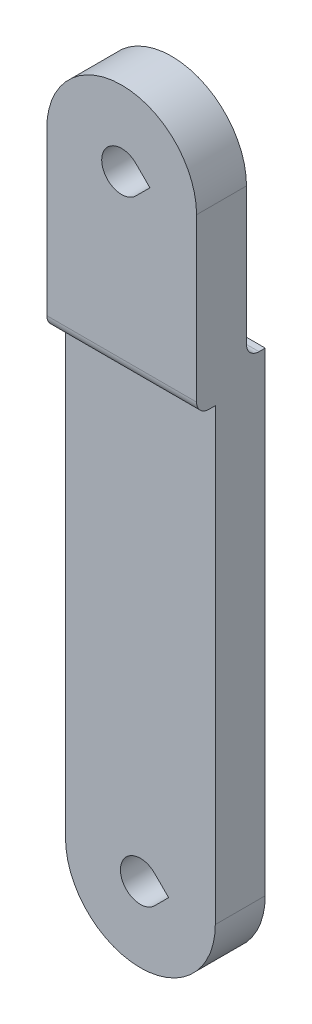
from build123d import *

# Parameters (mm, degrees)
EXTRUDE_1_DEPTH     = 11
SKETCH_2_W          = 14
SKETCH_2_H          = 18
SKETCH_2_W_2        = 11
SKETCH_2_H_2        = 41
SKETCH_2_W_3        = 1.5
SKETCH_2_H_3        = 42
CUT_EXTRUDE_1_DEPTH = 28
FILLET_1_R          = 1
SKETCH_3_W          = 132.309001911
SKETCH_3_H          = 95.019202257
CUT_EXTRUDE_2_DEPTH = 76


with BuildPart() as part:
    # 草图1 → 凸台-拉伸1 (new, symmetric)
    with BuildSketch(Plane.XY):
        with BuildLine():
            Line((6, 50), (6, 0))
            ThreePointArc((6, 0), (0, -6), (-6, 0))
            Line((-6, 0), (-6, 50))
            ThreePointArc((-6, 50), (0, 56), (6, 50))
        make_face()
        with BuildLine():
            Line((2.2627417, 50), (1.13137085, 51.13137085))
            ThreePointArc((1.13137085, 51.13137085), (-1.6, 50), (1.13137085, 48.86862915))
            Line((1.13137085, 48.86862915), (2.2627417, 50))
        make_face(mode=Mode.SUBTRACT)
        with BuildLine():
            Line((2.2627417, 0), (1.13137085, 1.13137085))
            ThreePointArc((1.13137085, 1.13137085), (-1.6, 0), (1.13137085, -1.13137085))
            Line((1.13137085, -1.13137085), (2.2627417, 0))
        make_face(mode=Mode.SUBTRACT)
    extrude(amount=EXTRUDE_1_DEPTH, both=True)

    # 草图2 → 切除-拉伸1 (cut)
    with BuildSketch(Plane(origin=(6, 0, 0), x_dir=(0, 0, -1), z_dir=(1, 0, 0))):
        with Locations((0, 47)):
            Rectangle(SKETCH_2_W, SKETCH_2_H)
        with Locations((0, 14.5)):
            Rectangle(SKETCH_2_W_2, SKETCH_2_H_2)
        with Locations((-10.25, 15)):
            Rectangle(SKETCH_2_W_3, SKETCH_2_H_3)
        with Locations((10.25, 15)):
            Rectangle(SKETCH_2_W_3, SKETCH_2_H_3)
    extrude(amount=-CUT_EXTRUDE_1_DEPTH, mode=Mode.SUBTRACT)

    # 圆角1
    fillet_1_edges = [part.edges().sort_by_distance(p)[0] for p in [
        (0, 36, -11),
        (0, 38, -7),
        (0, 38, 7),
        (0, 36, 11),
    ]]
    fillet(fillet_1_edges, radius=FILLET_1_R)

    # 草图3 → 切除-拉伸2 (cut)
    with BuildSketch(Plane(origin=(0, 0, 5.5), x_dir=(-1, 0, 0), z_dir=(0, 0, -1))):
        with Locations((2.071719377, 26.254861983)):
            Rectangle(SKETCH_3_W, SKETCH_3_H)
    extrude(amount=CUT_EXTRUDE_2_DEPTH, mode=Mode.SUBTRACT)


solid = part.part
